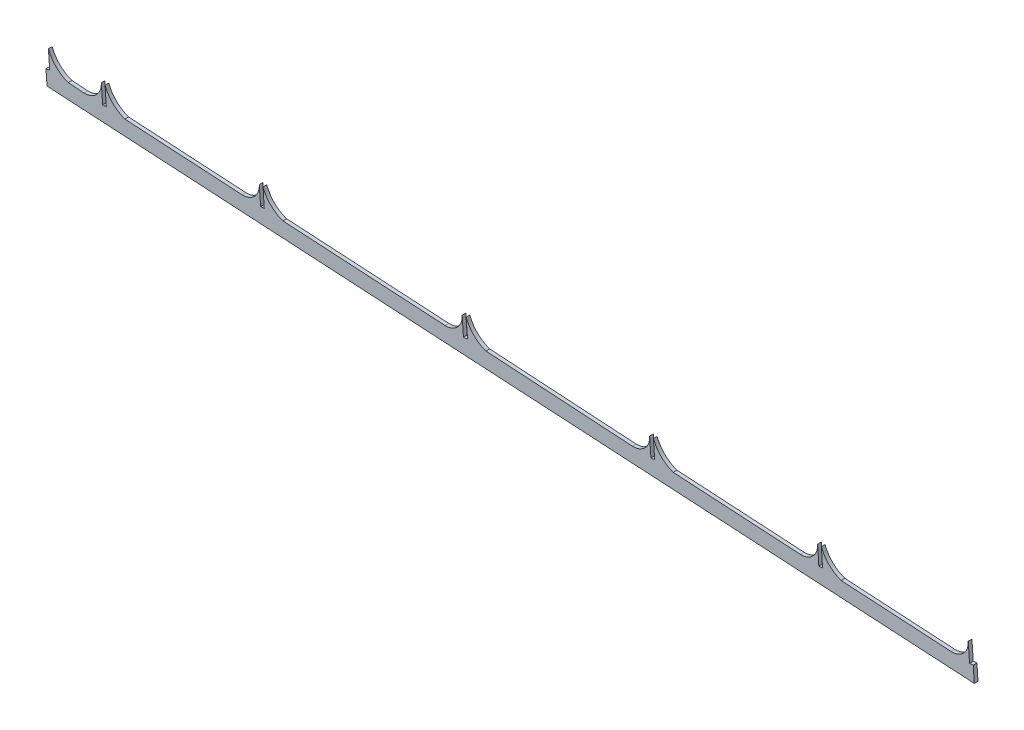
from build123d import *

# Parameters (mm, degrees)
EXTRUDE_3_DEPTH = 2


with BuildPart() as part:
    # Model → 凸台-拉伸3 (new body)
    with BuildSketch(Plane.XY):
        with BuildLine():
            Line((1009.845249225, 241.66910569), (509.606898133, 270.624061445))
            Line((509.606898133, 270.624061445), (509.055815885, 278.504904753))
            Line((509.055815885, 278.504904753), (511.050943986, 278.644417701))
            Line((511.050943986, 278.644417701), (510.3643132, 288.463695413))
            ThreePointArc((510.3643132, 288.463695413), (514.551498743, 282.04521462), (521.049056082, 277.981821077))
            Line((521.049056082, 277.981821077), (529.612636251, 277.414294002))
            ThreePointArc((529.612636251, 277.414294002), (536.352122923, 280.041562425), (538.898361675, 286.81207852))
            Line((538.898361675, 286.81207852), (539.595767949, 276.838704152))
            Line((539.595767949, 276.838704152), (541.59089605, 276.9782171))
            Line((541.59089605, 276.9782171), (540.911393269, 286.695559583))
            ThreePointArc((540.911393269, 286.695559583), (545.098578813, 280.277078791), (551.596136152, 276.213685247))
            Line((551.596136152, 276.213685247), (614.828609691, 272.481795853))
            ThreePointArc((614.828609691, 272.481795853), (621.568096364, 275.109064276), (624.114335116, 281.879580371))
            Line((624.114335116, 281.879580371), (624.810388767, 271.925549415))
            Line((624.810388767, 271.925549415), (626.805516867, 272.065062362))
            Line((626.805516867, 272.065062362), (626.12736671, 281.763061435))
            ThreePointArc((626.12736671, 281.763061435), (630.314552254, 275.344580642), (636.812109593, 271.281187098))
            Line((636.812109593, 271.281187098), (724.273187857, 266.14688988))
            ThreePointArc((724.273187857, 266.14688988), (731.01267453, 268.774158303), (733.558913282, 275.544674398))
            Line((733.558913282, 275.544674398), (734.253229731, 265.615486571))
            Line((734.253229731, 265.615486571), (736.497748845, 265.772438637))
            Line((736.497748845, 265.772438637), (735.70341722, 275.723004212))
            ThreePointArc((735.70341722, 275.723004212), (739.890602764, 269.304523419), (746.388160103, 265.241129876))
            Line((746.388160103, 265.241129876), (825.427946193, 260.291817902))
            ThreePointArc((825.427946193, 260.291817902), (832.167432866, 262.919086324), (834.713671617, 269.689602419))
            Line((834.713671617, 269.689602419), (835.40638245, 259.783375993))
            Line((835.40638245, 259.783375993), (837.40151055, 259.92288894))
            Line((837.40151055, 259.92288894), (836.726703211, 269.573083483))
            ThreePointArc((836.726703211, 269.573083483), (840.913888755, 263.15460269), (847.411446094, 259.091209147))
            Line((847.411446094, 259.091209147), (916.01436792, 255.048465753))
            ThreePointArc((916.01436792, 255.048465753), (922.753854593, 257.675734175), (925.300093345, 264.446250271))
            Line((925.300093345, 264.446250271), (925.995367783, 254.503362568))
            Line((925.995367783, 254.503362568), (927.990495884, 254.642875515))
            Line((927.990495884, 254.642875515), (927.313124938, 264.329731334))
            ThreePointArc((927.313124938, 264.329731334), (931.500310482, 257.911250542), (937.997867821, 253.847856998))
            Line((937.997867821, 253.847856998), (997.290875679, 250.343993013))
            ThreePointArc((997.290875679, 250.343993013), (1004.030362352, 252.971261436), (1006.576601104, 259.741777531))
            Line((1006.576601104, 259.741777531), (1007.275015261, 249.753989767))
            Line((1007.275015261, 249.753989767), (1009.270143361, 249.893502714))
            Line((1009.270143361, 249.893502714), (1009.845249225, 241.66910569))
        make_face()
    extrude(amount=EXTRUDE_3_DEPTH)


solid = part.part
